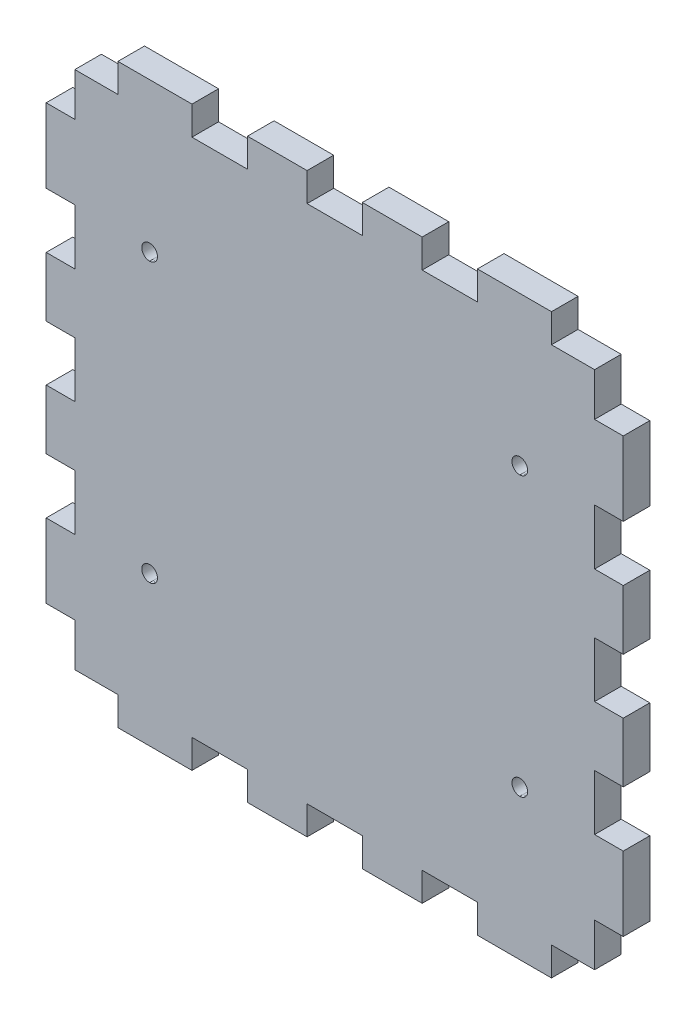
from build123d import *

# Parameters (mm, degrees)
BOSS_EXTRUDE1_DEPTH = 3.7


with BuildPart() as part:
    # Model → Boss-Extrude1 (new body)
    with BuildSketch(Plane.XY):
        Polygon((-5.997220875, 216.82832197), (1.346e-06, 216.82832197), (1.346e-06, 220.814711934), (10.301111378, 220.814711934), (10.301111378, 216.82832197), (18.026945247, 216.82832197), (18.026945247, 220.814711934), (26.31722235, 220.814711934), (26.31722235, 216.82832197), (34.007778034, 216.82832197), (34.007778034, 220.814711934), (42.333333323, 220.814711934), (42.333333323, 216.82832197), (50.023888607, 216.82832197), (50.023888607, 220.814711934), (60.325001331, 220.814711934), (60.325001331, 216.82832197), (66.322223551, 216.82832197), (66.322223551, 210.831099749), (70.308610824, 210.831099749), (70.308610824, 200.529989717), (66.322223551, 200.529989717), (66.322223551, 192.80415652), (70.308610824, 192.80415652), (70.308610824, 184.513878576), (66.322223551, 184.513878576), (66.322223551, 176.823322787), (70.308610824, 176.823322787), (70.308610824, 168.533045011), (66.322223551, 168.533045011), (66.322223551, 160.807212487), (70.308610824, 160.807212487), (70.308610824, 150.506099764), (66.322223551, 150.506099764), (66.322223551, 144.508877543), (60.325001331, 144.508877543), (60.325001331, 140.522487579), (50.023888607, 140.522487579), (50.023888607, 144.508877543), (42.333333323, 144.508877543), (42.333333323, 140.522487579), (34.007778034, 140.522487579), (34.007778034, 144.508877543), (26.31722235, 144.508877543), (26.31722235, 140.522487579), (18.026945247, 140.522487579), (18.026945247, 144.508877543), (10.301111378, 144.508877543), (10.301111378, 140.522487579), (1.346e-06, 140.522487579), (1.346e-06, 144.508877543), (-5.997220875, 144.508877543), (-5.997220875, 150.506099764), (-9.983610839, 150.506099764), (-9.983610839, 160.807212487), (-5.997220875, 160.807212487), (-5.997220875, 168.533045011), (-9.983610839, 168.533045011), (-9.983610839, 176.823322787), (-5.997220875, 176.823322787), (-5.997220875, 184.513878576), (-9.983610839, 184.513878576), (-9.983610839, 192.80415652), (-5.997220875, 192.80415652), (-5.997220875, 200.529989717), (-9.983610839, 200.529989717), (-9.983610839, 210.831099749), (-5.997220875, 210.831099749), align=None)
        with BuildLine():
            add(Edge.make_bspline(
                [(4.409715492, 198.940379596), (3.805731041, 198.940379596), (3.316103574, 199.430003026), (3.316103574, 200.03399286), (3.316103574, 200.637982694), (3.805731041, 201.127606124), (4.409715492, 201.127606124)],
                knots=[2, 2, 2, 2, 3, 3, 3, 4, 4, 4, 4], degree=3))
            add(Edge.make_bspline(
                [(4.409715492, 201.127606124), (5.013699944, 201.127606124), (5.503326065, 200.637982694), (5.503326065, 200.03399286), (5.503326065, 199.430003026), (5.013699944, 198.940379596), (4.409715492, 198.940379596)],
                knots=[0, 0, 0, 0, 1, 1, 1, 2, 2, 2, 2], degree=3))
        make_face(mode=Mode.SUBTRACT)
        with BuildLine():
            add(Edge.make_bspline(
                [(55.915272381, 160.205373146), (55.31128793, 160.205373146), (54.821661808, 160.694996576), (54.821661808, 161.298986411), (54.821661808, 161.902976245), (55.31128793, 162.392599675), (55.915272381, 162.392599675)],
                knots=[2, 2, 2, 2, 3, 3, 3, 4, 4, 4, 4], degree=3))
            add(Edge.make_bspline(
                [(55.915272381, 162.392599675), (56.519256832, 162.392599675), (57.008882953, 161.902976245), (57.008882953, 161.298986411), (57.008882953, 160.694996576), (56.519256832, 160.205373146), (55.915272381, 160.205373146)],
                knots=[0, 0, 0, 0, 1, 1, 1, 2, 2, 2, 2], degree=3))
        make_face(mode=Mode.SUBTRACT)
        with BuildLine():
            add(Edge.make_bspline(
                [(4.409715492, 160.205373146), (3.805731041, 160.205373146), (3.316103574, 160.694996576), (3.316103574, 161.298986411), (3.316103574, 161.902976245), (3.805731041, 162.392599675), (4.409715492, 162.392599675)],
                knots=[2, 2, 2, 2, 3, 3, 3, 4, 4, 4, 4], degree=3))
            add(Edge.make_bspline(
                [(4.409715492, 162.392599675), (5.013699944, 162.392599675), (5.503326065, 161.902976245), (5.503326065, 161.298986411), (5.503326065, 160.694996576), (5.013699944, 160.205373146), (4.409715492, 160.205373146)],
                knots=[0, 0, 0, 0, 1, 1, 1, 2, 2, 2, 2], degree=3))
        make_face(mode=Mode.SUBTRACT)
        with BuildLine():
            add(Edge.make_bspline(
                [(55.915272381, 198.940379596), (55.31128793, 198.940379596), (54.821661808, 199.430003026), (54.821661808, 200.03399286), (54.821661808, 200.637982694), (55.31128793, 201.127606124), (55.915272381, 201.127606124)],
                knots=[2, 2, 2, 2, 3, 3, 3, 4, 4, 4, 4], degree=3))
            add(Edge.make_bspline(
                [(55.915272381, 201.127606124), (56.519256832, 201.127606124), (57.008882953, 200.637982694), (57.008882953, 200.03399286), (57.008882953, 199.430003026), (56.519256832, 198.940379596), (55.915272381, 198.940379596)],
                knots=[0, 0, 0, 0, 1, 1, 1, 2, 2, 2, 2], degree=3))
        make_face(mode=Mode.SUBTRACT)
    extrude(amount=BOSS_EXTRUDE1_DEPTH)


solid = part.part
